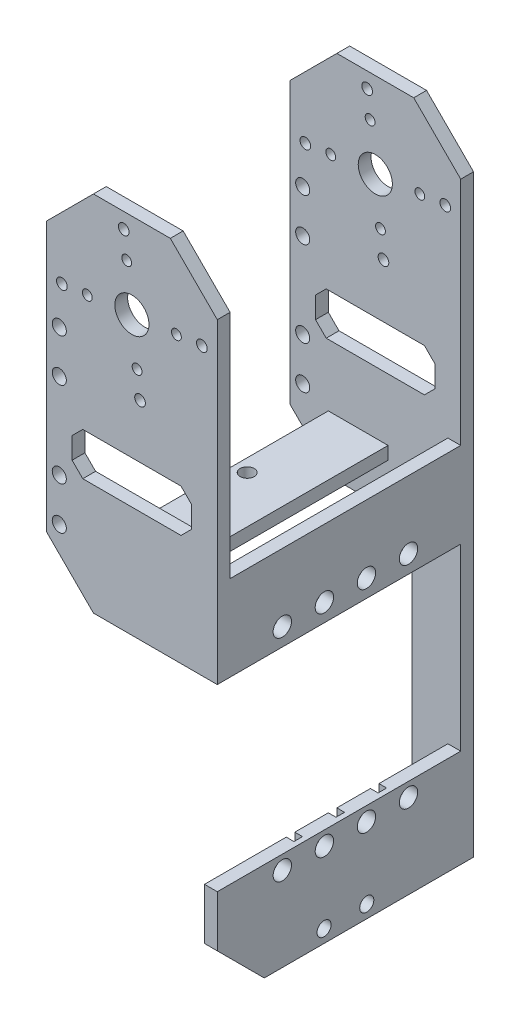
from build123d import *

# Parameters (mm, degrees)
SKETCH_1_W           = 40
SKETCH_1_H           = 60
EXTRUDE_1_DEPTH      = 30
CHAMFER_3_SIZE       = 11
SKETCH_6_W           = 40
SKETCH_6_H           = 54
CUT_EXTRUDE_4_DEPTH  = 80
SKETCH_7_R           = 4
CUT_EXTRUDE_5_DEPTH  = 80
SKETCH_9_R           = 1.25
SKETCH_9_R_2         = 1.15
CUT_EXTRUDE_6_DEPTH  = 80
SKETCH_10_W          = 40
SKETCH_10_H          = 3
EXTRUDE_2_DEPTH      = 90
SKETCH_11_W          = 3
SKETCH_11_H          = 20
EXTRUDE_3_DEPTH      = 54
SKETCH_13_W          = 3
SKETCH_13_H          = 27.7
EXTRUDE_4_DEPTH      = 54
SKETCH_12_R          = 2.15
CUT_EXTRUDE_7_DEPTH  = 10
SKETCH_15_W          = 40
SKETCH_15_H          = 42
CUT_EXTRUDE_8_DEPTH  = 80
SKETCH_16_W          = 37
SKETCH_16_H          = 23
CUT_EXTRUDE_9_DEPTH  = 40
SKETCH_17_W          = 2
SKETCH_17_H          = 8.3
CUT_EXTRUDE_10_DEPTH = 1.8
SKETCH_18_W          = 54
SKETCH_18_H          = 3
EXTRUDE_5_DEPTH      = 28
SKETCH_19_W          = 14
SKETCH_19_H          = 54
CUT_EXTRUDE_11_DEPTH = 11.5
CHAMFER_4_SIZE       = 11
SKETCH_24_R          = 1.7
CUT_EXTRUDE_12_DEPTH = 35
SKETCH_25_R          = 1.65
CUT_EXTRUDE_13_DEPTH = 35
CUT_EXTRUDE_14_DEPTH = 65
CUT_EXTRUDE_15_DEPTH = 45
SKETCH_29_W          = 33.502223789
SKETCH_29_H          = 63.386780399
CUT_EXTRUDE_16_DEPTH = 10
SKETCH_30_R          = 1.65
CUT_EXTRUDE_17_DEPTH = 70
SKETCH_31_R          = 1.65
CUT_EXTRUDE_18_DEPTH = 70
SKETCH_32_R          = 1.65
CUT_EXTRUDE_19_DEPTH = 70
SKETCH_33_R          = 1.65
CUT_EXTRUDE_20_DEPTH = 30
SKETCH_34_W          = 5
SKETCH_34_H          = 8.613219601
EXTRUDE_6_DEPTH      = 3
CHAMFER_5_SIZE       = 10
CHAMFER_6_SIZE       = 8


with BuildPart() as part:
    # 草图1 → 凸台-拉伸1 (new, symmetric)
    with BuildSketch(Plane.XY):
        Rectangle(SKETCH_1_W, SKETCH_1_H)
    extrude(amount=EXTRUDE_1_DEPTH, both=True)

    # 倒角3
    chamfer_3_edges = [part.edges().sort_by_distance(p)[0] for p in [
        (-20, 30, 0),
        (20, 30, 0),
    ]]
    chamfer(chamfer_3_edges, length=CHAMFER_3_SIZE)

    # 草图6 → 切除-拉伸4 (cut)
    with BuildSketch(Plane(origin=(0, 30, 0), x_dir=(1, 0, 0), z_dir=(0, 1, 0))):
        Rectangle(SKETCH_6_W, SKETCH_6_H)
    extrude(amount=-CUT_EXTRUDE_4_DEPTH, mode=Mode.SUBTRACT)


with BuildPart() as cut_extrude_4_piece_1:
    # of the separate pieces the step leaves, piece 1, a body of its own (cut_extrude_4_pieces)
    add(part.part.solids().sort_by_distance((-20, 19, -27))[0])


with BuildPart() as cut_extrude_4_piece_2:
    # of the separate pieces the step leaves, piece 2, a body of its own (cut_extrude_4_pieces)
    add(part.part.solids().sort_by_distance((-20, 19, 30))[0])


with BuildPart() as cut_extrude_5_tool:
    # 草图7 → 切除-拉伸5 (new body)
    with BuildSketch(Plane.XY.offset(30)):
        with Locations((0, 10)):
            Circle(SKETCH_7_R)
    extrude(amount=-CUT_EXTRUDE_5_DEPTH)


with BuildPart() as cut_extrude_4_piece_1_1:
    add(cut_extrude_4_piece_1.part)

    # 切除-拉伸5: cut by cut_extrude_5_tool
    add(cut_extrude_5_tool.part, mode=Mode.SUBTRACT)


with BuildPart() as cut_extrude_4_piece_2_1:
    add(cut_extrude_4_piece_2.part)

    # 切除-拉伸5: cut by cut_extrude_5_tool
    add(cut_extrude_5_tool.part, mode=Mode.SUBTRACT)


with BuildPart() as cut_extrude_6_tool:
    # 草图9 → 切除-拉伸6 (new body)
    with BuildSketch(Plane.XY.offset(30)):
        with Locations((-16.389233299, 8.091327193)):
            Circle(SKETCH_9_R)
        with Locations((-10.429512099, 8.785390032)):
            Circle(SKETCH_9_R_2)
        with Locations((-1.214609968, 20.429512099)):
            Circle(SKETCH_9_R_2)
        with Locations((-1.908672807, 26.389233299)):
            Circle(SKETCH_9_R)
        with Locations((10.429512099, 11.214609968)):
            Circle(SKETCH_9_R_2)
        with Locations((16.389233299, 11.908672807)):
            Circle(SKETCH_9_R)
        with Locations((1.214609968, -0.429512099)):
            Circle(SKETCH_9_R_2)
        with Locations((1.908672807, -6.389233299)):
            Circle(SKETCH_9_R)
    extrude(amount=-CUT_EXTRUDE_6_DEPTH)


with BuildPart() as cut_extrude_4_piece_1_2:
    add(cut_extrude_4_piece_1_1.part)

    # 切除-拉伸6: cut by cut_extrude_6_tool
    add(cut_extrude_6_tool.part, mode=Mode.SUBTRACT)



with BuildPart() as cut_extrude_4_piece_2_2:
    add(cut_extrude_4_piece_2_1.part)

    # 切除-拉伸6: cut by cut_extrude_6_tool
    add(cut_extrude_6_tool.part, mode=Mode.SUBTRACT)


with BuildPart() as cut_extrude_4_piece_1_3:
    add(cut_extrude_4_piece_1_2.part)

    add(cut_extrude_4_piece_2_2.part)  # 凸台-拉伸2 merges 切除-拉伸4 piece 2
    # 草图10 → 凸台-拉伸2 (add)
    with BuildSketch(Plane.XZ.offset(30)):
        with Locations((0, 28.5)):
            Rectangle(SKETCH_10_W, SKETCH_10_H)
        with Locations((0, -28.5)):
            Rectangle(SKETCH_10_W, SKETCH_10_H)
    extrude(amount=EXTRUDE_2_DEPTH)

    # 草图11 → 凸台-拉伸3 (add)
    with BuildSketch(Plane.XY.offset(-27)):
        with Locations((18.5, -45)):
            Rectangle(SKETCH_11_W, SKETCH_11_H)
    extrude(amount=EXTRUDE_3_DEPTH)

    # 草图13 → 凸台-拉伸4 (add)
    with BuildSketch(Plane.XY.offset(-27)):
        with Locations((18.5, -106.15)):
            Rectangle(SKETCH_13_W, SKETCH_13_H)
    extrude(amount=EXTRUDE_4_DEPTH)

    # 草图12 → 切除-拉伸7 (cut)
    with BuildSketch(Plane(origin=(20, 0, 0), x_dir=(0, 0, -1), z_dir=(1, 0, 0))):
        with Locations((-14.775, -50.85)):
            Circle(SKETCH_12_R)
        with Locations((-4.925, -50.85)):
            Circle(SKETCH_12_R)
        with Locations((-14.775, -100.27)):
            Circle(SKETCH_12_R)
        with Locations((-4.925, -100.27)):
            Circle(SKETCH_12_R)
        with Locations((4.925, -100.27)):
            Circle(SKETCH_12_R)
        with Locations((14.775, -100.27)):
            Circle(SKETCH_12_R)
        with Locations(Location((4.925, -50.85, 0), (0, 0, 90))):
            Circle(SKETCH_12_R)
        with Locations(Location((14.775, -50.85, 0), (0, 0, 90))):
            Circle(SKETCH_12_R)
    extrude(amount=-CUT_EXTRUDE_7_DEPTH, mode=Mode.SUBTRACT)

    # 草图15 → 切除-拉伸8 (cut)
    with BuildSketch(Plane.XY.offset(-27)):
        with Locations((0, -76)):
            Rectangle(SKETCH_15_W, SKETCH_15_H)
    extrude(amount=CUT_EXTRUDE_8_DEPTH, mode=Mode.SUBTRACT)

    # 草图16 → 切除-拉伸9 (cut)
    with BuildSketch(Plane(origin=(0, 0, 27), x_dir=(-1, 0, 0), z_dir=(0, 0, -1))):
        with Locations((1.5, -108.5)):
            Rectangle(SKETCH_16_W, SKETCH_16_H)
    extrude(amount=-CUT_EXTRUDE_9_DEPTH, mode=Mode.SUBTRACT)

    # 草图17 → 切除-拉伸10 (cut)
    with BuildSketch(Plane.ZY.offset(-17)):
        with Locations((0, -50.85)):
            Rectangle(SKETCH_17_W, SKETCH_17_H)
        with Locations((-9.85, -50.85)):
            Rectangle(SKETCH_17_W, SKETCH_17_H)
        with Locations((9.85, -50.85)):
            Rectangle(SKETCH_17_W, SKETCH_17_H)
        with Locations((9.85, -101.15)):
            Rectangle(SKETCH_17_W, SKETCH_17_H)
        with Locations((-9.85, -101.15)):
            Rectangle(SKETCH_17_W, SKETCH_17_H)
        with Locations((0, -101.15)):
            Rectangle(SKETCH_17_W, SKETCH_17_H)
    extrude(amount=-CUT_EXTRUDE_10_DEPTH, mode=Mode.SUBTRACT)

    # 草图18 → 凸台-拉伸5 (add)
    with BuildSketch(Plane.ZY.offset(-17)):
        with Locations((0, -45)):
            Rectangle(SKETCH_18_W, SKETCH_18_H)
    extrude(amount=EXTRUDE_5_DEPTH)

    # 草图19 → 切除-拉伸11 (cut)
    with BuildSketch(Plane(origin=(0, -43.5, 0), x_dir=(1, 0, 0), z_dir=(0, 1, 0))):
        with Locations((10, 0)):
            Rectangle(SKETCH_19_W, SKETCH_19_H)
    extrude(amount=-CUT_EXTRUDE_11_DEPTH, mode=Mode.SUBTRACT)

    # 倒角4
    chamfer_4_edges = [cut_extrude_4_piece_1_3.edges().sort_by_distance(p)[0] for p in [
        (-20, -55, 28.5),
        (18.5, -120, 30),
        (-20, -120, -28.5),
    ]]
    chamfer(chamfer_4_edges, length=CHAMFER_4_SIZE)

    # 草图24 → 切除-拉伸12 (cut)
    with BuildSketch(Plane.XY.offset(-27)):
        with Locations((-14, -79)):
            Circle(SKETCH_24_R)
        with Locations((-14, -89)):
            Circle(SKETCH_24_R)
    extrude(amount=-CUT_EXTRUDE_12_DEPTH, mode=Mode.SUBTRACT)

    # 草图25 → 切除-拉伸13 (cut)
    with BuildSketch(Plane.XY.offset(-27)):
        with Locations((3, -116)):
            Circle(SKETCH_25_R)
        with Locations((13, -116)):
            Circle(SKETCH_25_R)
    extrude(amount=-CUT_EXTRUDE_13_DEPTH, mode=Mode.SUBTRACT)

    # 草图27 → 切除-拉伸14 (cut)
    with BuildSketch(Plane(origin=(0, 0, -30), x_dir=(-1, 0, 0), z_dir=(0, 0, -1))):
        Polygon((-14, -21.5), (-11.5, -19), (11.5, -19), (14, -21.5), (14, -26.5), (11.5, -29), (-11.5, -29), (-14, -26.5), align=None)
    extrude(amount=-CUT_EXTRUDE_14_DEPTH, mode=Mode.SUBTRACT)

    # 草图28 → 切除-拉伸15 (cut)
    with BuildSketch(Plane(origin=(0, 0, -30), x_dir=(-1, 0, 0), z_dir=(0, 0, -1))):
        Polygon((-4, -105), (-1, -105), (-1, -81), (-4, -81), (-7, -84), (-7, -102), align=None)
        Polygon((7.5, -70), (9.5, -70), (12.5, -67), (12.5, -51), (9.5, -48), (7.5, -48), align=None)
    extrude(amount=-CUT_EXTRUDE_15_DEPTH, mode=Mode.SUBTRACT)

    # 草图29 → 切除-拉伸16 (cut)
    with BuildSketch(Plane.XY.offset(-27)):
        with Locations((-8.200271599, -88.306609801)):
            Rectangle(SKETCH_29_W, SKETCH_29_H)
    extrude(amount=-CUT_EXTRUDE_16_DEPTH, mode=Mode.SUBTRACT)

    # 草图30 → 切除-拉伸17 (cut, symmetric)
    with BuildSketch(Plane.XY.offset(30)):
        with Locations(Location((-17, -31, 0), (0, 0, 180))):
            Circle(SKETCH_30_R)
        with Locations(Location((-17, -41, 0), (0, 0, 180))):
            Circle(SKETCH_30_R)
    extrude(amount=CUT_EXTRUDE_17_DEPTH, both=True, mode=Mode.SUBTRACT)

    # 草图31 → 切除-拉伸18 (cut)
    with BuildSketch(Plane.XY.offset(30)):
        with Locations(Location((-17, -11, 0), (0, 0, 180))):
            Circle(SKETCH_31_R)
        with Locations(Location((-17, -1, 0), (0, 0, 180))):
            Circle(SKETCH_31_R)
    extrude(amount=-CUT_EXTRUDE_18_DEPTH, mode=Mode.SUBTRACT)

    # 草图32 → 切除-拉伸19 (cut)
    with BuildSketch(Plane(origin=(0, -43.5, 0), x_dir=(1, 0, 0), z_dir=(0, 1, 0))):
        with Locations(Location((-8, 5, 0), (0, 0, 270))):
            Circle(SKETCH_32_R)
        with Locations(Location((-8, -5, 0), (0, 0, 270))):
            Circle(SKETCH_32_R)
    extrude(amount=-CUT_EXTRUDE_19_DEPTH, mode=Mode.SUBTRACT)

    # 草图33 → 切除-拉伸20 (cut)
    with BuildSketch(Plane(origin=(20, 0, 0), x_dir=(0, 0, -1), z_dir=(1, 0, 0))):
        with Locations((-5, -117)):
            Circle(SKETCH_33_R)
        with Locations((5, -117)):
            Circle(SKETCH_33_R)
    extrude(amount=-CUT_EXTRUDE_20_DEPTH, mode=Mode.SUBTRACT)

    # 草图34 → 凸台-拉伸6 (add)
    with BuildSketch(Plane(origin=(0, 0, -30), x_dir=(-1, 0, 0), z_dir=(0, 0, -1))):
        with Locations((10, -52.3066098)):
            Rectangle(SKETCH_34_W, SKETCH_34_H)
    extrude(amount=-EXTRUDE_6_DEPTH)

    # 倒角5
    chamfer_5_edges = [cut_extrude_4_piece_1_3.edges().sort_by_distance(p)[0] for p in [
        (-20, -56.613219601, -28.5),
    ]]
    chamfer(chamfer_5_edges, length=CHAMFER_5_SIZE)

    # 倒角6
    chamfer_6_edges = [cut_extrude_4_piece_1_3.edges().sort_by_distance(p)[0] for p in [
        (8.550840296, -56.613219601, -28.5),
    ]]
    chamfer(chamfer_6_edges, length=CHAMFER_6_SIZE)


solid = cut_extrude_4_piece_1_3.part
